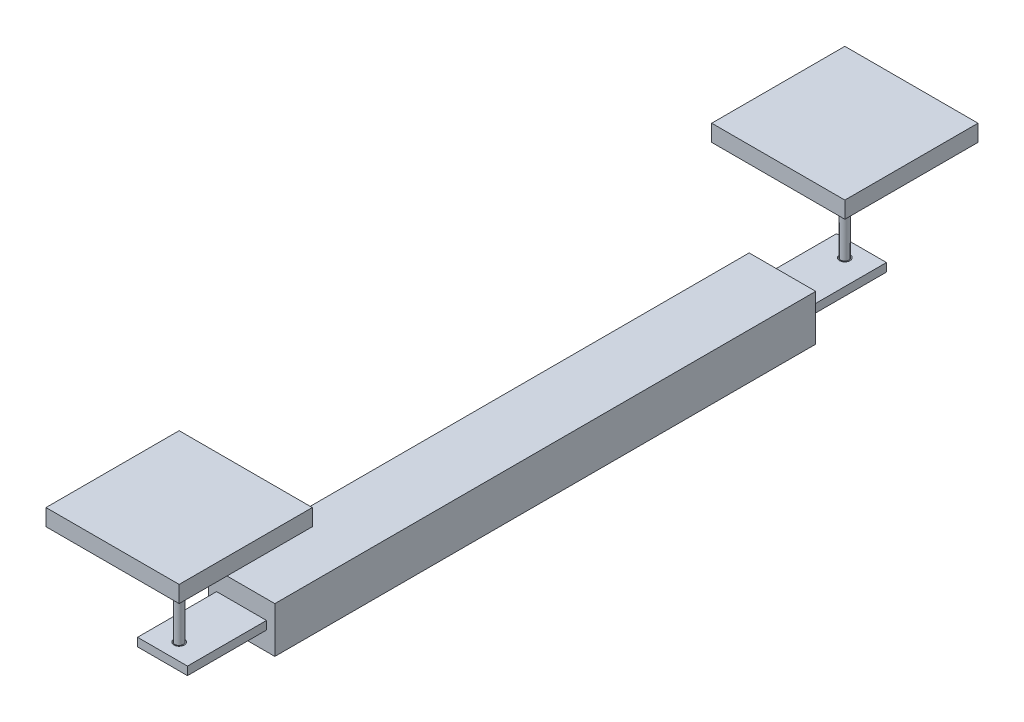
from build123d import *

# Parameters (mm, degrees)
SKETCH2_W             = 533.4
SKETCH2_H             = 6.35
BOSS_EXTRUDE1_DEPTH   = 19.05
SKETCH3_W             = 412.75
SKETCH3_H             = 34.925
BOSS_EXTRUDE2_DEPTH   = 25.4
SKETCH4_R             = 3.96875
CUT_EXTRUDE1_DEPTH    = 269.700495731
SKETCH5_R             = 3.175
BOSS_EXTRUDE3_DEPTH   = 76.2
BOSS_EXTRUDE3_2_DEPTH = 76.2
SKETCH6_W             = 101.6
SKETCH6_H             = 101.6
BOSS_EXTRUDE4_DEPTH   = 12.7


with BuildPart() as part:
    # Sketch2 → Boss-Extrude1 (new, symmetric)
    with BuildSketch(Plane(origin=(0, 0, 0), x_dir=(0, 0, -1), z_dir=(1, 0, 0))):
        Rectangle(SKETCH2_W, SKETCH2_H)
    extrude(amount=BOSS_EXTRUDE1_DEPTH, both=True)

    # Sketch3 → Boss-Extrude2 (add, symmetric)
    with BuildSketch(Plane(origin=(0, 0, 0), x_dir=(0, 0, -1), z_dir=(1, 0, 0))):
        Rectangle(SKETCH3_W, SKETCH3_H)
    extrude(amount=BOSS_EXTRUDE2_DEPTH, both=True)

    # Sketch4 → Cut-Extrude1 (cut, through all)
    with BuildSketch(Plane(origin=(0, 3.175, 0), x_dir=(1, 0, 0), z_dir=(0, 1, 0))):
        with Locations(Location((0, 254, 0), (0, 0, 270))):
            Circle(SKETCH4_R)
        with Locations(Location((0, -254, 0), (0, 0, 270))):
            Circle(SKETCH4_R)
    extrude(amount=-CUT_EXTRUDE1_DEPTH, mode=Mode.SUBTRACT)


with BuildPart() as body_2:
    # Sketch5 → Boss-Extrude3 (new body)
    with BuildSketch(Plane(origin=(0, 3.175, 0), x_dir=(1, 0, 0), z_dir=(0, 1, 0))):
        with Locations(Location((0, 254, 0), (0, 0, 90))):
            Circle(SKETCH5_R)
    extrude(amount=BOSS_EXTRUDE3_DEPTH)



with BuildPart() as body_3:
    # Sketch5 → Boss-Extrude3 2 (new body)
    with BuildSketch(Plane(origin=(0, 3.175, 0), x_dir=(1, 0, 0), z_dir=(0, 1, 0))):
        with Locations(Location((0, -254, 0), (0, 0, 90))):
            Circle(SKETCH5_R)
    extrude(amount=BOSS_EXTRUDE3_2_DEPTH)


with BuildPart() as body_2_1:
    add(body_2.part)

    add(body_3.part)  # Boss-Extrude4 merges body 3
    # Sketch6 → Boss-Extrude4 (add)
    with BuildSketch(Plane(origin=(0, 79.375, 0), x_dir=(1, 0, 0), z_dir=(0, 1, 0))):
        with Locations((0, 254)):
            Rectangle(SKETCH6_W, SKETCH6_H)
        with Locations((0, -254)):
            Rectangle(SKETCH6_W, SKETCH6_H)
    extrude(amount=BOSS_EXTRUDE4_DEPTH)


solid = Compound([part.part, body_2_1.part])
